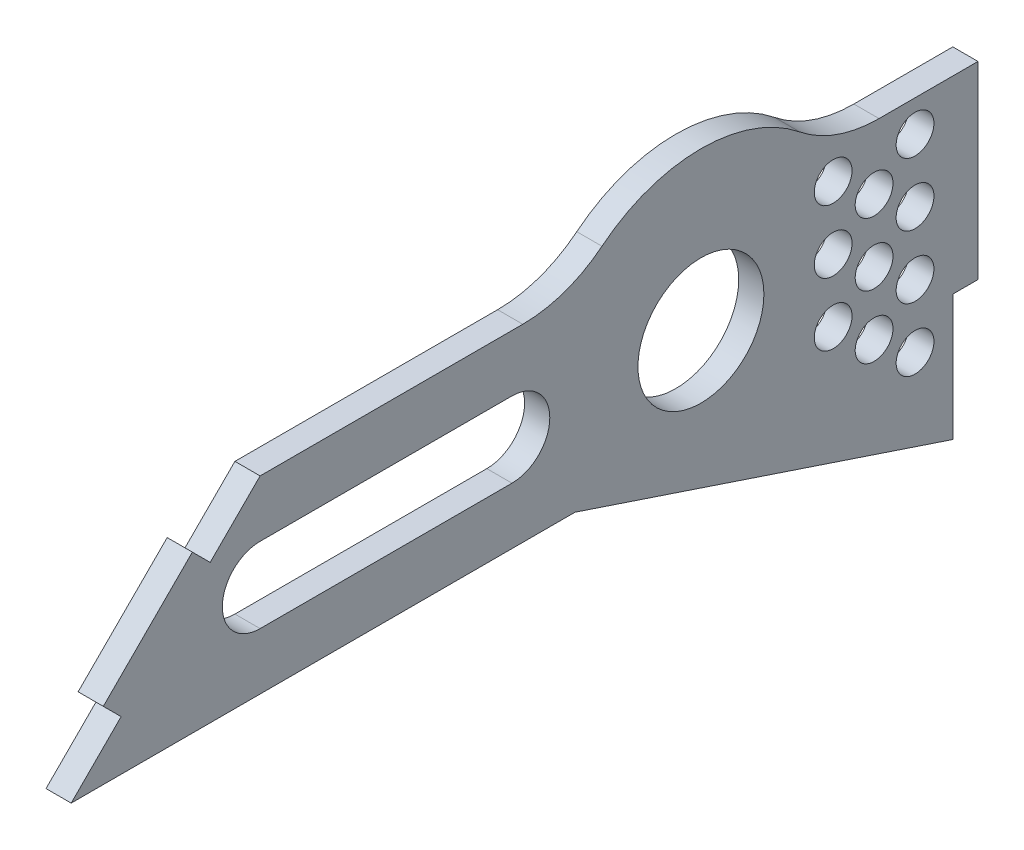
from build123d import *

# Parameters (mm, degrees)
SKETCH2_R               = 10
SKETCH2_R_2             = 3
BOSS_EXTRUDE1_DEPTH     = 4
CUT_EXTRUDE3_DEPTH      = 128.285567155
CUT_EXTRUDE3_DEPTH_BACK = 128.285567155


with BuildPart() as part:
    # Sketch2 → Boss-Extrude1 (new body)
    with BuildSketch(Plane(origin=(0, 0, 0), x_dir=(0, 0, -1), z_dir=(1, 0, 0))):
        with BuildLine():
            Line((119, 9), (119, 44.995728753))
            Line((119, 44.995728753), (94, 44.995728753))
            Line((94, 44.995728753), (94, 24.715728753))
            ThreePointArc((94, 24.715728753), (89.39696962, 13.60303038), (78.284271247, 9))
            ThreePointArc((78.284271247, 9), (71.617604581, 10.143819168), (65.713484026, 13.444444444))
            ThreePointArc((65.713484026, 13.444444444), (50, 19), (34.286515974, 13.444444444))
            ThreePointArc((34.286515974, 13.444444444), (28.382395419, 10.143819168), (21.715728753, 9))
            Line((21.715728753, 9), (-20, 9))
            Line((-20, 9), (-27.928932188, 1.071067812))
            Line((-27.928932188, 1.071067812), (-30.757359313, 3.899494937))
            Line((-30.757359313, 3.899494937), (-44.899494937, -10.242640687))
            Line((-44.899494937, -10.242640687), (-42.071067812, -13.071067812))
            Line((-42.071067812, -13.071067812), (-50, -21))
            Line((-50, -21), (18.196601125, -21))
            Line((18.196601125, -21), (30, -21))
            Line((30, -21), (90, -41))
            Line((90, -41), (90, -21))
            Line((90, -21), (94, -21))
            Line((94, -21), (94, -41))
            Line((94, -41), (119, 9))
        make_face()
        with Locations((50, -6)):
            Circle(SKETCH2_R, mode=Mode.SUBTRACT)
        with Locations((106.5, -6)):
            Circle(SKETCH2_R_2, mode=Mode.SUBTRACT)
        with Locations((106.5, 4)):
            Circle(SKETCH2_R_2, mode=Mode.SUBTRACT)
        with Locations((113, 9)):
            Circle(SKETCH2_R_2, mode=Mode.SUBTRACT)
        with Locations((106.5, 14)):
            Circle(SKETCH2_R_2, mode=Mode.SUBTRACT)
        with Locations((113, 19)):
            Circle(SKETCH2_R_2, mode=Mode.SUBTRACT)
        with Locations((106.5, 24)):
            Circle(SKETCH2_R_2, mode=Mode.SUBTRACT)
        with Locations((113, 29)):
            Circle(SKETCH2_R_2, mode=Mode.SUBTRACT)
        with Locations((113, 39)):
            Circle(SKETCH2_R_2, mode=Mode.SUBTRACT)
        with Locations((106.5, 34)):
            Circle(SKETCH2_R_2, mode=Mode.SUBTRACT)
        with Locations((100, 39)):
            Circle(SKETCH2_R_2, mode=Mode.SUBTRACT)
        with Locations((100, 29)):
            Circle(SKETCH2_R_2, mode=Mode.SUBTRACT)
        with Locations((100, 19)):
            Circle(SKETCH2_R_2, mode=Mode.SUBTRACT)
        with Locations((100, 9)):
            Circle(SKETCH2_R_2, mode=Mode.SUBTRACT)
        with Locations((100, -1)):
            Circle(SKETCH2_R_2, mode=Mode.SUBTRACT)
        with Locations((100, -11)):
            Circle(SKETCH2_R_2, mode=Mode.SUBTRACT)
        with Locations((84, 4)):
            Circle(SKETCH2_R_2, mode=Mode.SUBTRACT)
        with Locations((71, 4)):
            Circle(SKETCH2_R_2, mode=Mode.SUBTRACT)
        with Locations((77.5, -1)):
            Circle(SKETCH2_R_2, mode=Mode.SUBTRACT)
        with Locations((84, -6)):
            Circle(SKETCH2_R_2, mode=Mode.SUBTRACT)
        with Locations((84, -16)):
            Circle(SKETCH2_R_2, mode=Mode.SUBTRACT)
        with Locations((77.5, -11)):
            Circle(SKETCH2_R_2, mode=Mode.SUBTRACT)
        with Locations((71, -6)):
            Circle(SKETCH2_R_2, mode=Mode.SUBTRACT)
        with Locations((71, -16)):
            Circle(SKETCH2_R_2, mode=Mode.SUBTRACT)
        with Locations((84, -26)):
            Circle(SKETCH2_R_2, mode=Mode.SUBTRACT)
        with Locations((77.5, -21)):
            Circle(SKETCH2_R_2, mode=Mode.SUBTRACT)
        with BuildLine():
            Line((20, 0), (-20, 0))
            ThreePointArc((-20, 0), (-26, -6), (-20, -12))
            Line((-20, -12), (20, -12))
            ThreePointArc((20, -12), (26, -6), (20, 0))
        make_face(mode=Mode.SUBTRACT)
    extrude(amount=BOSS_EXTRUDE1_DEPTH)

    # Sketch3 → Cut-Extrude3 (cut, two sides: drawn at the far end of the back side and taken through both)
    with BuildSketch(Plane(origin=(0, 0, 0), x_dir=(0, 0, -1), z_dir=(1, 0, 0)).offset(-CUT_EXTRUDE3_DEPTH_BACK)):
        Polygon((94, -21), (94, 9), (78.284271247, 9), (78.284271247, 52.431858837), (131.189267146, 52.431858837), (131.189267146, -47.367568871), (90.840116585, -47.367568871), align=None)
    extrude(amount=CUT_EXTRUDE3_DEPTH + CUT_EXTRUDE3_DEPTH_BACK, mode=Mode.SUBTRACT)


solid = part.part
